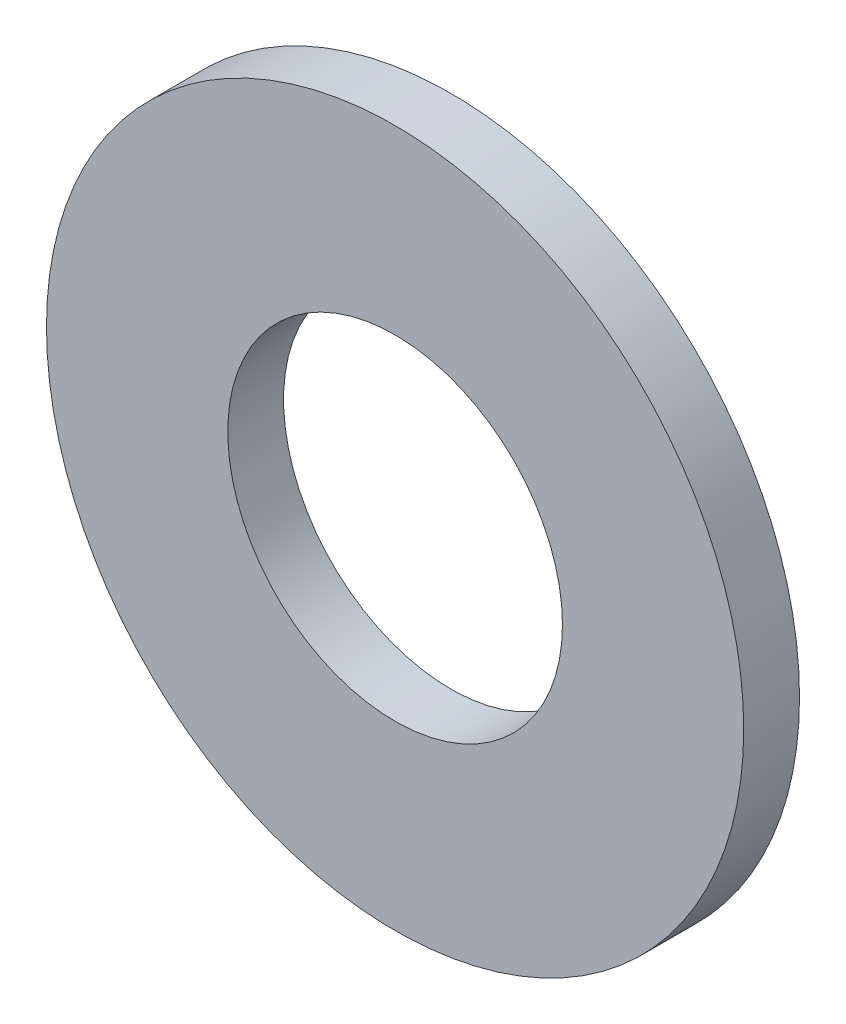
from build123d import *

# Parameters (mm, degrees)
SKETCH1_R      = 12.5
SKETCH1_R_2    = 6
EXTRUDE1_DEPTH = 2


with BuildPart() as part:
    # Sketch1 → Extrude1 (new body)
    with BuildSketch(Plane.XY):
        Circle(SKETCH1_R)
        Circle(SKETCH1_R_2, mode=Mode.SUBTRACT)
    extrude(amount=EXTRUDE1_DEPTH)


solid = part.part
